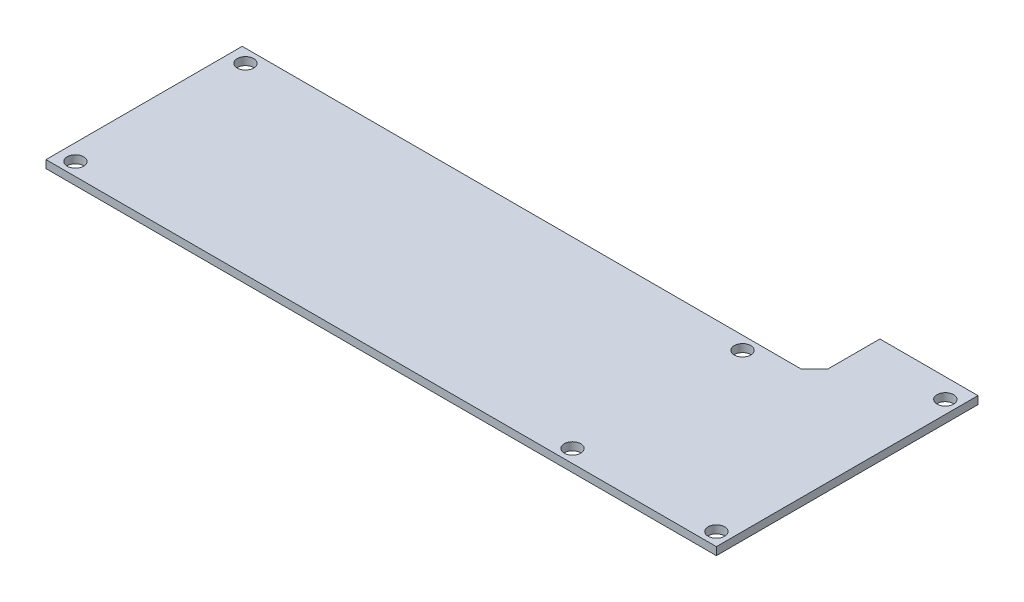
from build123d import *

# Parameters (mm, degrees)
SKETCH1_W                  = 130.175
SKETCH1_H                  = 50.8
BOSS_EXTRUDE1_DEPTH        = 1.524
CUT_EXTRUDE1_REACH         = 71.885
SKETCH6_W                  = 111.125
SKETCH6_H                  = 12.7
CHAMFER2_SIZE              = 2.54
F_3_2_3_2_DIAMETER_HOLE1_D = 3.2


with BuildPart() as part:
    # Sketch1 → Boss-Extrude1 (new body)
    with BuildSketch(Plane(origin=(0, 0, 0), x_dir=(1, 0, 0), z_dir=(0, 1, 0))):
        Rectangle(SKETCH1_W, SKETCH1_H)
    extrude(amount=BOSS_EXTRUDE1_DEPTH)

    # Sketch6 → Cut-Extrude1 (cut, up to next)
    with BuildSketch(Plane(origin=(0, 1.524, 0), x_dir=(1, 0, 0), z_dir=(0, 1, 0)), mode=Mode.PRIVATE) as cut_extrude1_sk1:
        with Locations((-9.525, 19.05)):
            Rectangle(SKETCH6_W, SKETCH6_H)
    cut_extrude1_tool1 = extrude(cut_extrude1_sk1.sketch, amount=-CUT_EXTRUDE1_REACH, mode=Mode.PRIVATE) & part.part
    add(cut_extrude1_tool1.solids().sort_by_distance((-9.525, 1.524, -19.05))[0], mode=Mode.SUBTRACT)

    # Chamfer2
    chamfer2_edges = [part.edges().sort_by_distance(p)[0] for p in [
        (46.0375, 0.762, -12.7),
    ]]
    chamfer(chamfer2_edges, length=CHAMFER2_SIZE)

    # Ø3.2 (3.2) Diameter Hole1 (through all)
    with Locations(Plane(origin=(0, 1.524, 0), x_dir=(-1, 0, 0), z_dir=(0, 1, 0))):
        with Locations((-62.5475, 22.86), (-62.5475, -21.59), (-34.6075, 22.86), (-34.6075, -10.16), (61.9125, 22.86), (61.9125, -10.16)):
            Hole(F_3_2_3_2_DIAMETER_HOLE1_D / 2)


solid = part.part
